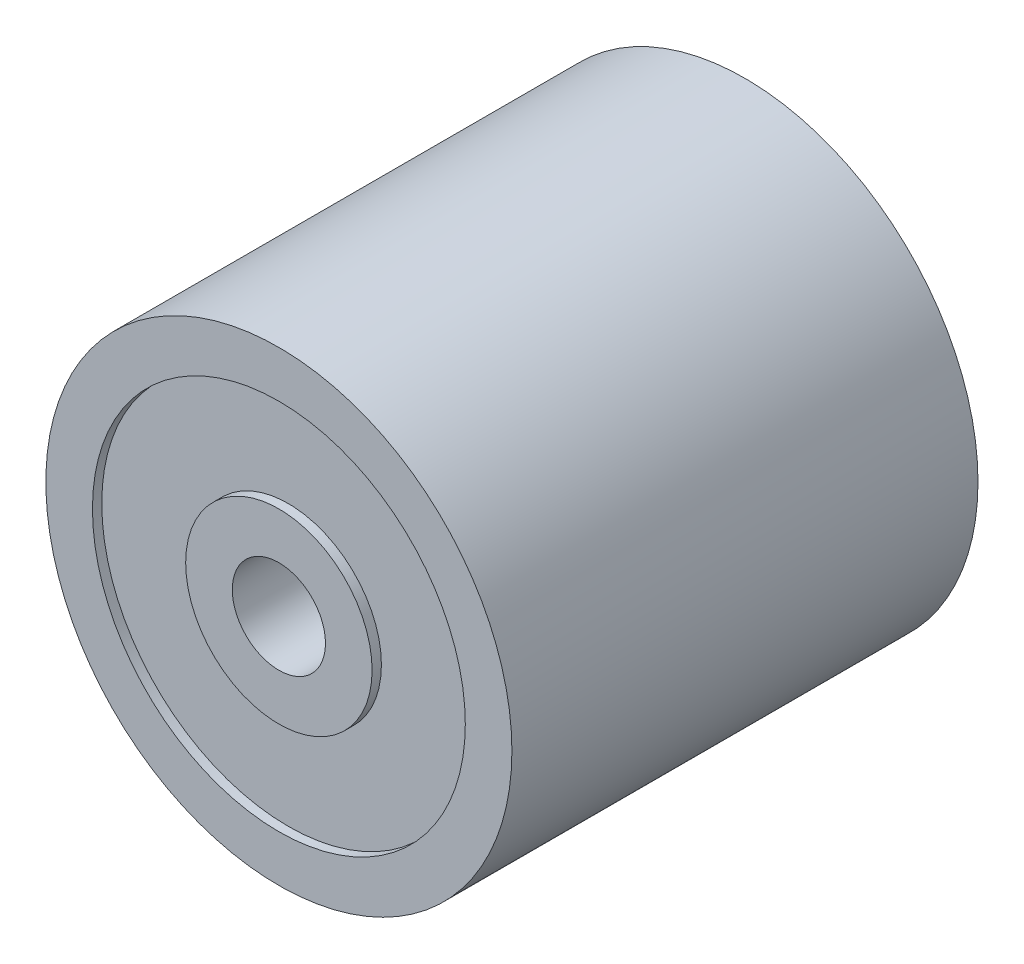
from build123d import *

# Parameters (mm, degrees)
SKETCH1_R           = 6.35
SKETCH1_R_2         = 1.27
BOSS_EXTRUDE1_DEPTH = 12.7
SKETCH2_R           = 5.08
SKETCH2_R_2         = 2.54
CUT_EXTRUDE1_DEPTH  = 0.254


with BuildPart() as part:
    # Sketch1 → Boss-Extrude1 (new body)
    with BuildSketch(Plane.XY):
        Circle(SKETCH1_R)
        Circle(SKETCH1_R_2, mode=Mode.SUBTRACT)
    extrude(amount=BOSS_EXTRUDE1_DEPTH)

    # Sketch2 → Cut-Extrude1 (cut)
    with BuildSketch(Plane.XY.offset(12.7)):
        Circle(SKETCH2_R)
        Circle(SKETCH2_R_2, mode=Mode.SUBTRACT)
    cut_extrude1 = extrude(amount=-CUT_EXTRUDE1_DEPTH, mode=Mode.SUBTRACT)

    # Mirror1: Cut-Extrude1 across plane
    add(cut_extrude1.mirror(Plane.XY.offset(6.35)), mode=Mode.SUBTRACT)


solid = part.part
